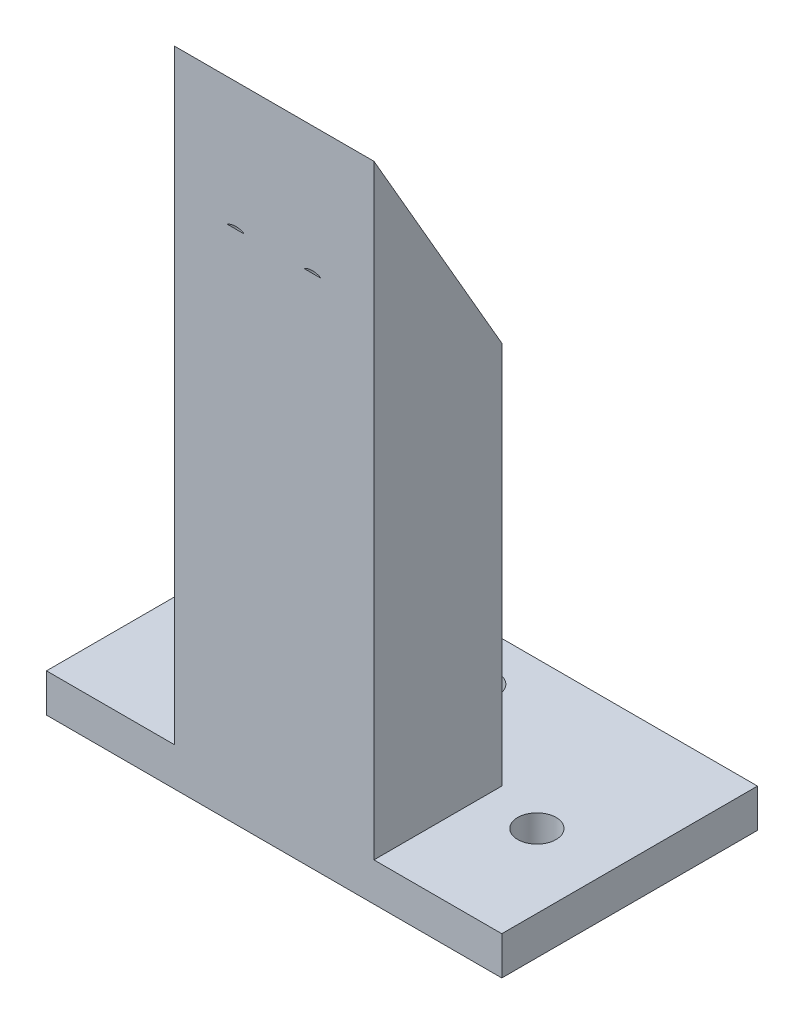
from build123d import *

# Parameters (mm, degrees)
SKETCH1_W           = 35.61
SKETCH1_H           = 20
BOSS_EXTRUDE1_DEPTH = 3
SKETCH3_R           = 1.5
CUT_EXTRUDE1_DEPTH  = 5
SKETCH7_W           = 15.61
SKETCH7_H           = 10
BOSS_EXTRUDE4_DEPTH = 30
BOSS_EXTRUDE5_DEPTH = 15.61
SKETCH9_R           = 1.5
CUT_EXTRUDE2_DEPTH  = 5


with BuildPart() as part:
    # Sketch1 → Boss-Extrude1 (new body)
    with BuildSketch(Plane(origin=(0, 0, 0), x_dir=(1, 0, 0), z_dir=(0, 1, 0))):
        with Locations((-8.436781609, 10.25)):
            Rectangle(SKETCH1_W, SKETCH1_H)
    extrude(amount=BOSS_EXTRUDE1_DEPTH)

    # Sketch3 → Cut-Extrude1 (cut)
    with BuildSketch(Plane.XZ):
        with Locations(Location((-20.484687418, -8.75, 0), (0, 0, 270))):
            Circle(SKETCH3_R)
        with Locations(Location((-8.434877213, -16.25, 0), (0, 0, 270))):
            Circle(SKETCH3_R)
        with Locations(Location((3.614932992, -8.75, 0), (0, 0, 270))):
            Circle(SKETCH3_R)
    extrude(amount=-CUT_EXTRUDE1_DEPTH, mode=Mode.SUBTRACT)

    # Sketch7 → Boss-Extrude4 (add)
    with BuildSketch(Plane(origin=(0, 3, 0), x_dir=(1, 0, 0), z_dir=(0, 1, 0))):
        with Locations((-8.436781609, 5.25)):
            Rectangle(SKETCH7_W, SKETCH7_H)
    extrude(amount=BOSS_EXTRUDE4_DEPTH)

    # Sketch8 → Boss-Extrude5 (add)
    with BuildSketch(Plane.ZY.offset(16.241781609)):
        Polygon((-10.25, 33), (-0.25, 50.320508076), (-0.25, 33), align=None)
    extrude(amount=-BOSS_EXTRUDE5_DEPTH)

    # Sketch9 → Cut-Extrude2 (cut)
    with BuildSketch(Plane(origin=(0, 12.688380194, -21.976919162), x_dir=(1, 0, 0), z_dir=(0, 0.4999999999999978, -0.8660254037844399))):
        with Locations(Location((-11.436781609, -33.453838325, 0), (0, 0, 270))):
            Circle(SKETCH9_R)
        with Locations(Location((-5.436781609, -33.453838325, 0), (0, 0, 270))):
            Circle(SKETCH9_R)
    extrude(amount=-CUT_EXTRUDE2_DEPTH, mode=Mode.SUBTRACT)


solid = part.part
